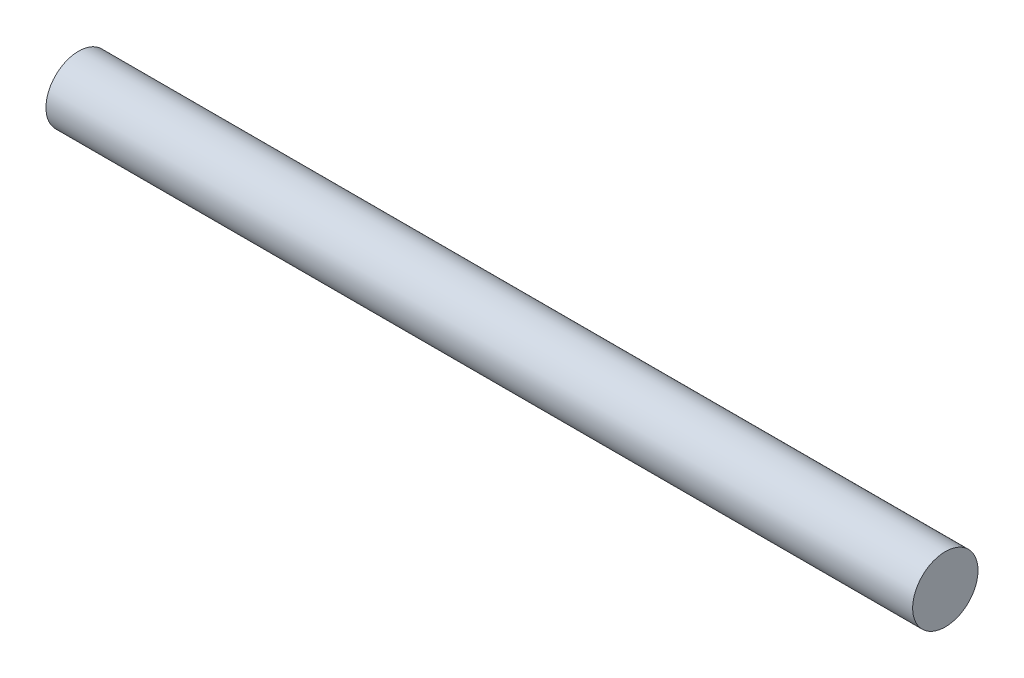
from build123d import *

# Parameters (mm, degrees)
SKETCH1_R           = 19.05
BOSS_EXTRUDE1_DEPTH = 505.54


with BuildPart() as part:
    # Sketch1 → Boss-Extrude1 (new body)
    with BuildSketch(Plane(origin=(0, 0, 0), x_dir=(0, 0, -1), z_dir=(1, 0, 0))):
        Circle(SKETCH1_R)
    extrude(amount=BOSS_EXTRUDE1_DEPTH)


solid = part.part
